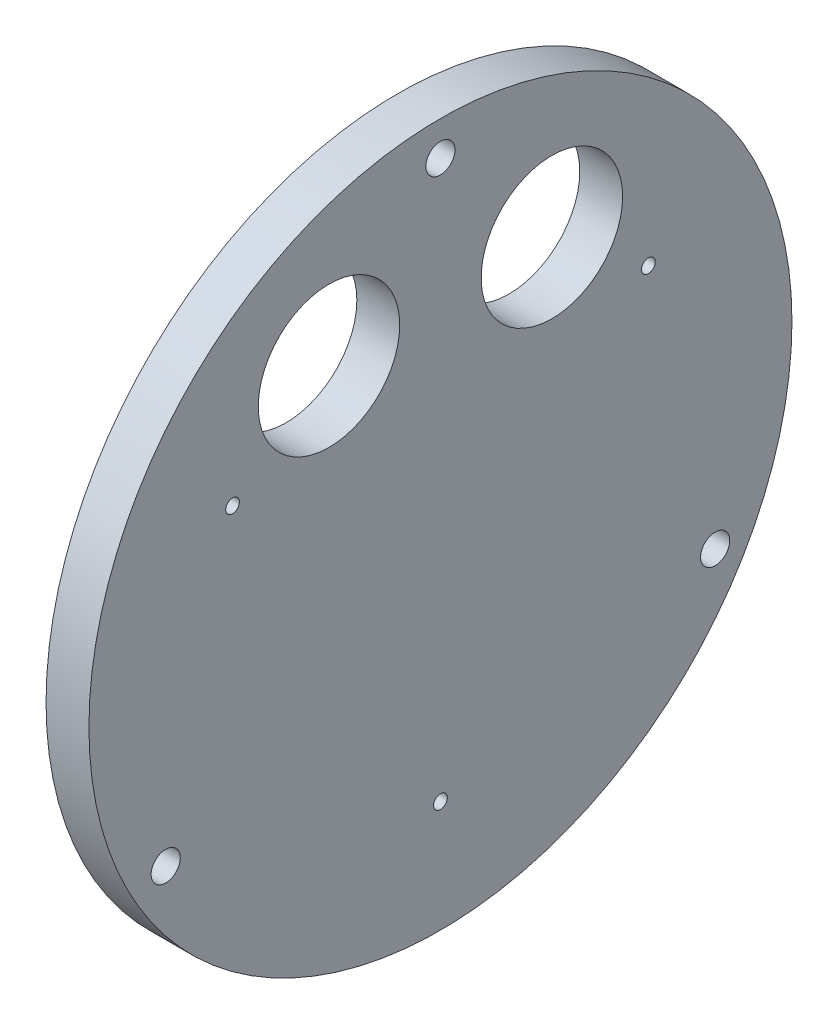
from build123d import *

# Parameters (mm, degrees)
AXIAL_BLANK_PROFILE_W                          = 5
AXIAL_BLANK_PROFILE_H                          = 41
TWO_START                                      = -22
TWO_FITTING_ROUTE_CLEARANCE_BORES_DI_2_R       = 8.25
TWO_FITTING_ROUTE_CLEARANCE_BORES_DIAMET_DEPTH = 5
THREE_START                                    = -22
THREE_LONG_MOUNTING_SCREW_CLEARANCES_SKE_R     = 1.7
THREE_LONG_MOUNTING_SCREW_CLEARANCES_DEPTH     = 5
THREE_START_2                                  = -20
THREE_M2_LOCATOR_RECEIVING_PILOTS_DE_2_R       = 0.8
THREE_M2_LOCATOR_RECEIVING_PILOTS_DEPTH3_DEPTH = 3


with BuildPart() as part:
    # Axial blank profile → Native revolved blank (revolve)
    with BuildSketch(Plane.XY, mode=Mode.PRIVATE) as native_revolved_blank_sk:
        with Locations((-19.5, 20.5)):
            Rectangle(AXIAL_BLANK_PROFILE_W, AXIAL_BLANK_PROFILE_H)
    revolve(native_revolved_blank_sk.sketch.rotate(Axis((-60, 0, 0), (1, 0, 0)), 90), axis=Axis((-60, 0, 0), (1, 0, 0)))

    # Two fitting-route clearance bores di 2 → Two fitting-route clearance bores diamet (cut)
    with BuildSketch(Plane(origin=(0, 0, 0), x_dir=(0, 0, -1), z_dir=(1, 0, 0)).offset(TWO_START)):
        with Locations((-13, 22.516660498)):
            Circle(TWO_FITTING_ROUTE_CLEARANCE_BORES_DI_2_R)
        with Locations((13, 22.516660498)):
            Circle(TWO_FITTING_ROUTE_CLEARANCE_BORES_DI_2_R)
    extrude(amount=TWO_FITTING_ROUTE_CLEARANCE_BORES_DIAMET_DEPTH, mode=Mode.SUBTRACT)

    # Three long mounting screw clearances sketch → Three long mounting screw clearances (cut)
    with BuildSketch(Plane(origin=(0, 0, 0), x_dir=(0, 0, -1), z_dir=(1, 0, 0)).offset(THREE_START)):
        with Locations((0, 37)):
            Circle(THREE_LONG_MOUNTING_SCREW_CLEARANCES_SKE_R)
        with Locations((-32.04293994, -18.5)):
            Circle(THREE_LONG_MOUNTING_SCREW_CLEARANCES_SKE_R)
        with Locations((32.04293994, -18.5)):
            Circle(THREE_LONG_MOUNTING_SCREW_CLEARANCES_SKE_R)
    extrude(amount=THREE_LONG_MOUNTING_SCREW_CLEARANCES_DEPTH, mode=Mode.SUBTRACT)

    # Three M2 locator receiving pilots de 2 → Three M2 locator receiving pilots depth3 (cut)
    with BuildSketch(Plane(origin=(0, 0, 0), x_dir=(0, 0, -1), z_dir=(1, 0, 0)).offset(THREE_START_2)):
        with Locations((-24.248711306, 14)):
            Circle(THREE_M2_LOCATOR_RECEIVING_PILOTS_DE_2_R)
        with Locations((0, -28)):
            Circle(THREE_M2_LOCATOR_RECEIVING_PILOTS_DE_2_R)
        with Locations((24.248711306, 14)):
            Circle(THREE_M2_LOCATOR_RECEIVING_PILOTS_DE_2_R)
    extrude(amount=THREE_M2_LOCATOR_RECEIVING_PILOTS_DEPTH3_DEPTH, mode=Mode.SUBTRACT)


solid = part.part
